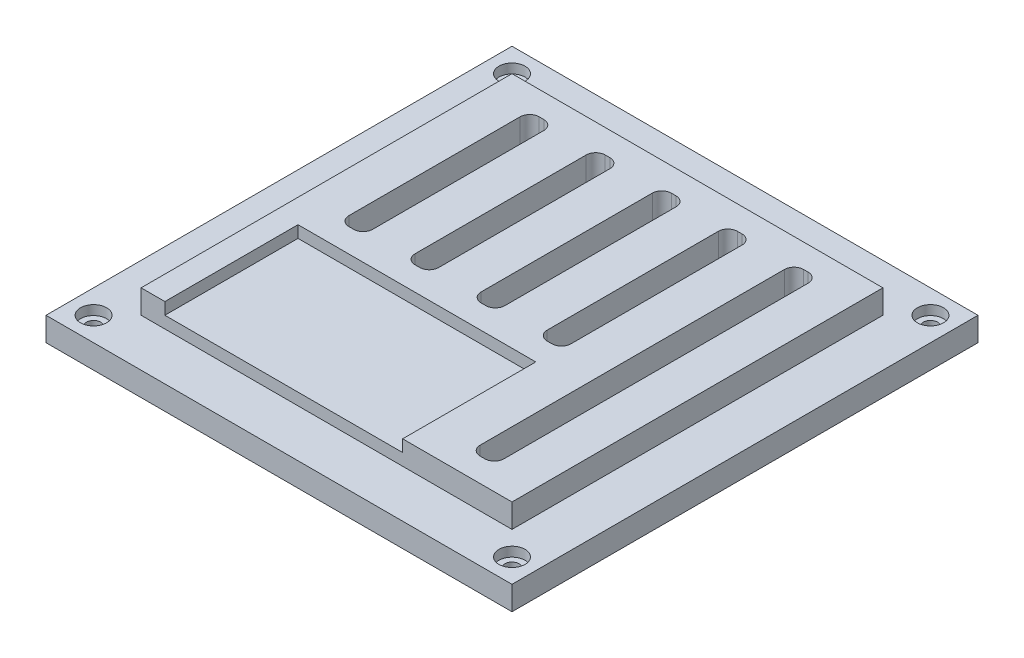
from build123d import *

# Parameters (mm, degrees)
SKETCH1_W           = 98
SKETCH1_H           = 98
BOSS_EXTRUDE2_DEPTH = 10
SKETCH2_W           = 98
SKETCH2_H           = 98
SKETCH2_W_2         = 78
SKETCH2_H_2         = 78
CUT_EXTRUDE2_DEPTH  = 5
SKETCH3_R           = 2.75
CUT_EXTRUDE3_DEPTH  = 2
SKETCH4_R           = 1.5
CUT_EXTRUDE4_DEPTH  = 9
SKETCH6_W           = 50
SKETCH6_H           = 28
CUT_EXTRUDE6_DEPTH  = 2.5
CUT_EXTRUDE8_DEPTH  = 11.5


with BuildPart() as part:
    # Sketch1 → Boss-Extrude2 (new body)
    with BuildSketch(Plane(origin=(0, 0, 0), x_dir=(1, 0, 0), z_dir=(0, 1, 0))):
        Rectangle(SKETCH1_W, SKETCH1_H)
    extrude(amount=BOSS_EXTRUDE2_DEPTH)

    # Sketch2 → Cut-Extrude2 (cut)
    with BuildSketch(Plane(origin=(0, 10, 0), x_dir=(1, 0, 0), z_dir=(0, 1, 0))):
        Rectangle(SKETCH2_W, SKETCH2_H)
        Rectangle(SKETCH2_W_2, SKETCH2_H_2, mode=Mode.SUBTRACT)
    extrude(amount=-CUT_EXTRUDE2_DEPTH, mode=Mode.SUBTRACT)

    # Sketch3 → Cut-Extrude3 (cut)
    with BuildSketch(Plane(origin=(0, 5, 0), x_dir=(1, 0, 0), z_dir=(0, 1, 0))):
        with Locations(Location((-44, -44, 0), (0, 0, 270))):
            Circle(SKETCH3_R)
        with Locations(Location((44, -44, 0), (0, 0, 270))):
            Circle(SKETCH3_R)
        with Locations(Location((-44, 44, 0), (0, 0, 270))):
            Circle(SKETCH3_R)
        with Locations(Location((44, 44, 0), (0, 0, 270))):
            Circle(SKETCH3_R)
    extrude(amount=-CUT_EXTRUDE3_DEPTH, mode=Mode.SUBTRACT)

    # Sketch4 → Cut-Extrude4 (cut)
    with BuildSketch(Plane(origin=(0, 3, 0), x_dir=(1, 0, 0), z_dir=(0, 1, 0))):
        with Locations(Location((-44, 44, 0), (0, 0, 270))):
            Circle(SKETCH4_R)
        with Locations(Location((44, 44, 0), (0, 0, 270))):
            Circle(SKETCH4_R)
        with Locations(Location((44, -44, 0), (0, 0, 270))):
            Circle(SKETCH4_R)
        with Locations(Location((-44, -44, 0), (0, 0, 270))):
            Circle(SKETCH4_R)
    extrude(amount=-CUT_EXTRUDE4_DEPTH, mode=Mode.SUBTRACT)

    # Sketch6 → Cut-Extrude6 (cut)
    with BuildSketch(Plane(origin=(0, 10, 0), x_dir=(1, 0, 0), z_dir=(0, 1, 0))):
        with Locations((-9, -25)):
            Rectangle(SKETCH6_W, SKETCH6_H)
    extrude(amount=-CUT_EXTRUDE6_DEPTH, mode=Mode.SUBTRACT)

    # Sketch7 → Cut-Extrude8 (cut)
    with BuildSketch(Plane(origin=(0, 10, 0), x_dir=(1, 0, 0), z_dir=(0, 1, 0))):
        with BuildLine():
            ThreePointArc((-30.3, 32), (-29.714213562, 33.414213562), (-28.3, 34))
            Line((-28.3, 34), (-27.3, 34))
            ThreePointArc((-27.3, 34), (-25.885786438, 33.414213562), (-25.3, 32))
            Line((-25.3, 32), (-25.3, -4))
            ThreePointArc((-25.3, -4), (-25.885786438, -5.414213562), (-27.3, -6))
            Line((-27.3, -6), (-28.3, -6))
            ThreePointArc((-28.3, -6), (-29.714213562, -5.414213562), (-30.3, -4))
            Line((-30.3, -4), (-30.3, 32))
        make_face()
        with BuildLine():
            ThreePointArc((-14.4, -6), (-15.814213562, -5.414213562), (-16.4, -4))
            Line((-16.4, -4), (-16.4, 32))
            ThreePointArc((-16.4, 32), (-15.814213562, 33.414213562), (-14.4, 34))
            Line((-14.4, 34), (-13.4, 34))
            ThreePointArc((-13.4, 34), (-11.985786438, 33.414213562), (-11.4, 32))
            Line((-11.4, 32), (-11.4, -4))
            ThreePointArc((-11.4, -4), (-11.985786438, -5.414213562), (-13.4, -6))
            Line((-13.4, -6), (-14.4, -6))
        make_face()
        with BuildLine():
            ThreePointArc((-0.5, -6), (-1.914213562, -5.414213562), (-2.5, -4))
            Line((-2.5, -4), (-2.5, 32))
            ThreePointArc((-2.5, 32), (-1.914213562, 33.414213562), (-0.5, 34))
            Line((-0.5, 34), (0.5, 34))
            ThreePointArc((0.5, 34), (1.914213562, 33.414213562), (2.5, 32))
            Line((2.5, 32), (2.5, -4))
            ThreePointArc((2.5, -4), (1.914213562, -5.414213562), (0.5, -6))
            Line((0.5, -6), (-0.5, -6))
        make_face()
        with BuildLine():
            ThreePointArc((13.4, -6), (11.985786438, -5.414213562), (11.4, -4))
            Line((11.4, -4), (11.4, 32))
            ThreePointArc((11.4, 32), (11.985786438, 33.414213562), (13.4, 34))
            Line((13.4, 34), (14.4, 34))
            ThreePointArc((14.4, 34), (15.814213562, 33.414213562), (16.4, 32))
            Line((16.4, 32), (16.4, -4))
            ThreePointArc((16.4, -4), (15.814213562, -5.414213562), (14.4, -6))
            Line((14.4, -6), (13.4, -6))
        make_face()
        with BuildLine():
            ThreePointArc((27.3, -34), (25.885786438, -33.414213562), (25.3, -32))
            Line((25.3, -32), (25.3, -6))
            Line((25.3, -6), (25.3, 32))
            ThreePointArc((25.3, 32), (25.885786438, 33.414213562), (27.3, 34))
            Line((27.3, 34), (28.3, 34))
            ThreePointArc((28.3, 34), (29.714213562, 33.414213562), (30.3, 32))
            Line((30.3, 32), (30.3, -6))
            Line((30.3, -6), (30.3, -32))
            ThreePointArc((30.3, -32), (29.714213562, -33.414213562), (28.3, -34))
            Line((28.3, -34), (27.3, -34))
        make_face()
    extrude(amount=-CUT_EXTRUDE8_DEPTH, mode=Mode.SUBTRACT)


solid = part.part
